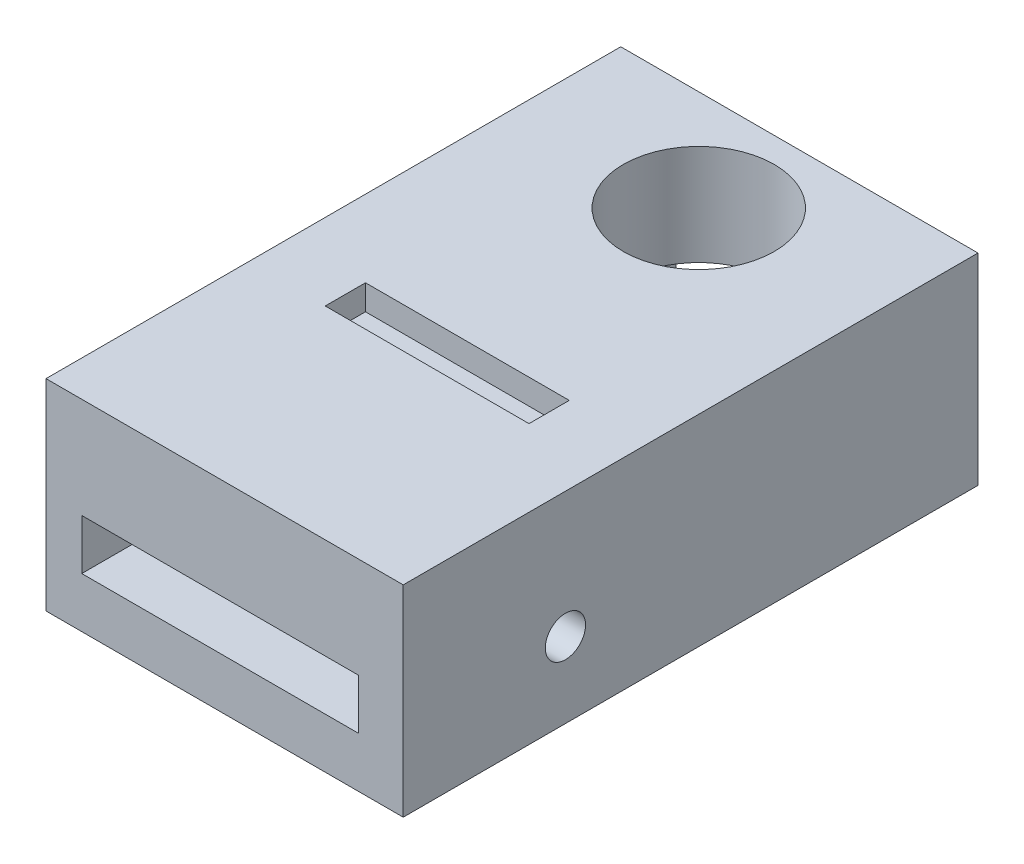
from build123d import *

# Parameters (mm, degrees)
SKETCH1_W           = 71
SKETCH1_H           = 64.24
BOSS_EXTRUDE1_DEPTH = 40
SKETCH2_R           = 4
CUT_EXTRUDE2_DEPTH  = 10
SKETCH5_W           = 71
SKETCH5_H           = 40
BOSS_EXTRUDE2_DEPTH = 50
SKETCH6_R           = 15
CUT_EXTRUDE3_DEPTH  = 98.999716326
SKETCH8_W           = 40.5
SKETCH8_H           = 8
CUT_EXTRUDE5_DEPTH  = 5
CUT_EXTRUDE6_START  = -10
SKETCH9_R           = 4
CUT_EXTRUDE6_DEPTH  = 10
SKETCH10_W          = 55
SKETCH10_H          = 10
CUT_EXTRUDE7_DEPTH  = 127.138921828
SKETCH11_W          = 51.11
SKETCH11_H          = 38
CUT_EXTRUDE8_DEPTH  = 10


with BuildPart() as part:
    # Sketch1 → Boss-Extrude1 (new body)
    with BuildSketch(Plane(origin=(0, 0, 0), x_dir=(1, 0, 0), z_dir=(0, 1, 0))):
        Rectangle(SKETCH1_W, SKETCH1_H)
    extrude(amount=BOSS_EXTRUDE1_DEPTH)

    # Sketch2 → Cut-Extrude2 (cut)
    with BuildSketch(Plane.ZY.offset(35.5)):
        with Locations((-0.12, 15)):
            Circle(SKETCH2_R)
    extrude(amount=-CUT_EXTRUDE2_DEPTH, mode=Mode.SUBTRACT)

    # Sketch5 → Boss-Extrude2 (add)
    with BuildSketch(Plane(origin=(0, 0, -32.12), x_dir=(-1, 0, 0), z_dir=(0, 0, -1))):
        with Locations((0, 20)):
            Rectangle(SKETCH5_W, SKETCH5_H)
    extrude(amount=BOSS_EXTRUDE2_DEPTH)

    # Sketch6 → Cut-Extrude3 (cut, through all)
    with BuildSketch(Plane(origin=(0, 40, 0), x_dir=(1, 0, 0), z_dir=(0, 1, 0))):
        with Locations(Location((0, 62.12, 0), (0, 0, 270))):
            Circle(SKETCH6_R)
    extrude(amount=-CUT_EXTRUDE3_DEPTH, mode=Mode.SUBTRACT)

    # Sketch8 → Cut-Extrude5 (cut)
    with BuildSketch(Plane(origin=(0, 40, 0), x_dir=(1, 0, 0), z_dir=(0, 1, 0))):
        with Locations((0, 12.13)):
            Rectangle(SKETCH8_W, SKETCH8_H)
    extrude(amount=-CUT_EXTRUDE5_DEPTH, mode=Mode.SUBTRACT)

    # Sketch9 → Cut-Extrude6 (cut)
    with BuildSketch(Plane(origin=(35.5, 0, 0), x_dir=(0, 0, -1), z_dir=(1, 0, 0)).offset(CUT_EXTRUDE6_START)):
        with Locations(Location((0.12, 15, 0), (0, 0, 180))):
            Circle(SKETCH9_R)
    extrude(amount=CUT_EXTRUDE6_DEPTH, mode=Mode.SUBTRACT)

    # Sketch10 → Cut-Extrude7 (cut, through all)
    with BuildSketch(Plane.XY.offset(32.12)):
        with Locations((-0.890825636, 15)):
            Rectangle(SKETCH10_W, SKETCH10_H)
    extrude(amount=-CUT_EXTRUDE7_DEPTH, mode=Mode.SUBTRACT)

    # Sketch11 → Cut-Extrude8 (cut)
    with BuildSketch(Plane(origin=(0, 0, 0), x_dir=(-1, 0, 0), z_dir=(0, -1, 0))):
        with Locations((-1.055, 63.12)):
            Rectangle(SKETCH11_W, SKETCH11_H)
    extrude(amount=-CUT_EXTRUDE8_DEPTH, mode=Mode.SUBTRACT)


solid = part.part
